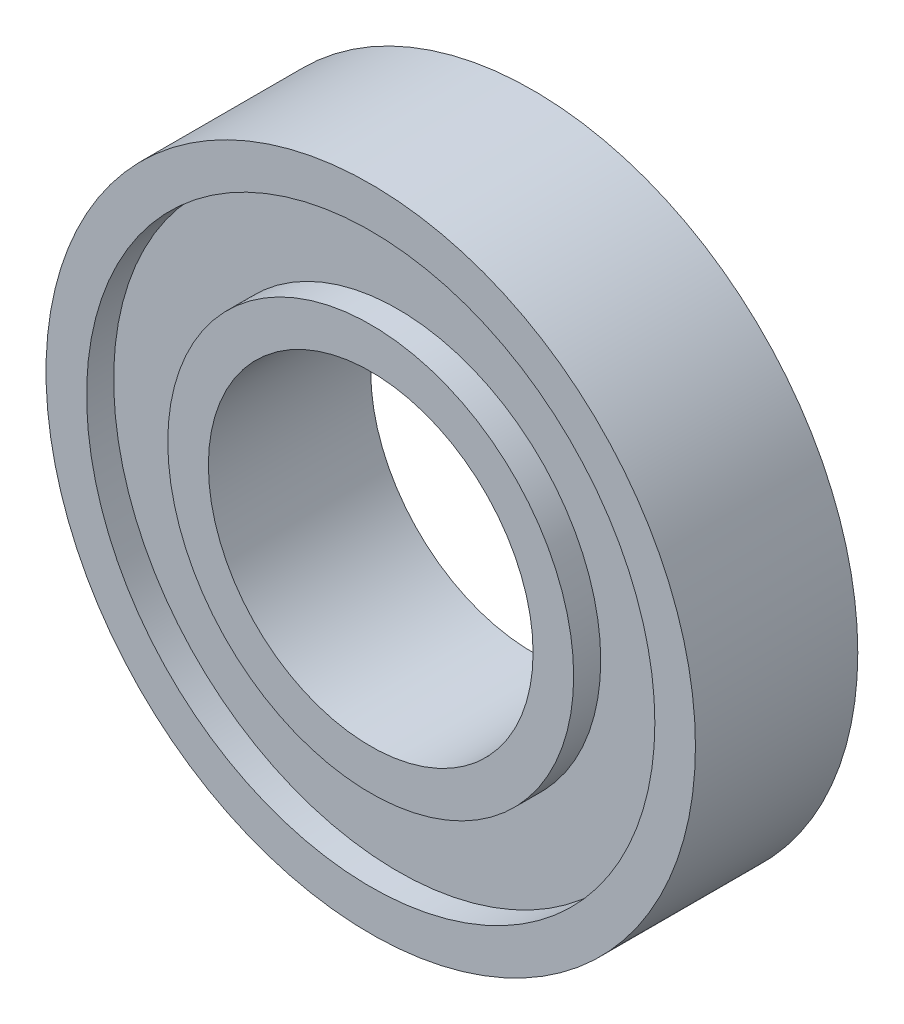
from build123d import *

# Parameters (mm, degrees)
SKETCH_1_R          = 6
SKETCH_1_R_2        = 3
EXTRUDE_1_DEPTH     = 1.5
SKETCH_2_R          = 5.25
SKETCH_2_R_2        = 3.75
CUT_EXTRUDE_1_DEPTH = 0.5


with BuildPart() as part:
    # 草图1 → 凸台-拉伸1 (new, symmetric)
    with BuildSketch(Plane.XY):
        Circle(SKETCH_1_R)
        Circle(SKETCH_1_R_2, mode=Mode.SUBTRACT)
    extrude(amount=EXTRUDE_1_DEPTH, both=True)

    # 草图2 → 切除-拉伸1 (cut)
    with BuildSketch(Plane.XY.offset(1.5)):
        Circle(SKETCH_2_R)
        Circle(SKETCH_2_R_2, mode=Mode.SUBTRACT)
    cut_extrude_1 = extrude(amount=-CUT_EXTRUDE_1_DEPTH, mode=Mode.SUBTRACT)

    # 镜向1: 切除-拉伸1 across plane
    add(cut_extrude_1.mirror(Plane.XY), mode=Mode.SUBTRACT)


solid = part.part
